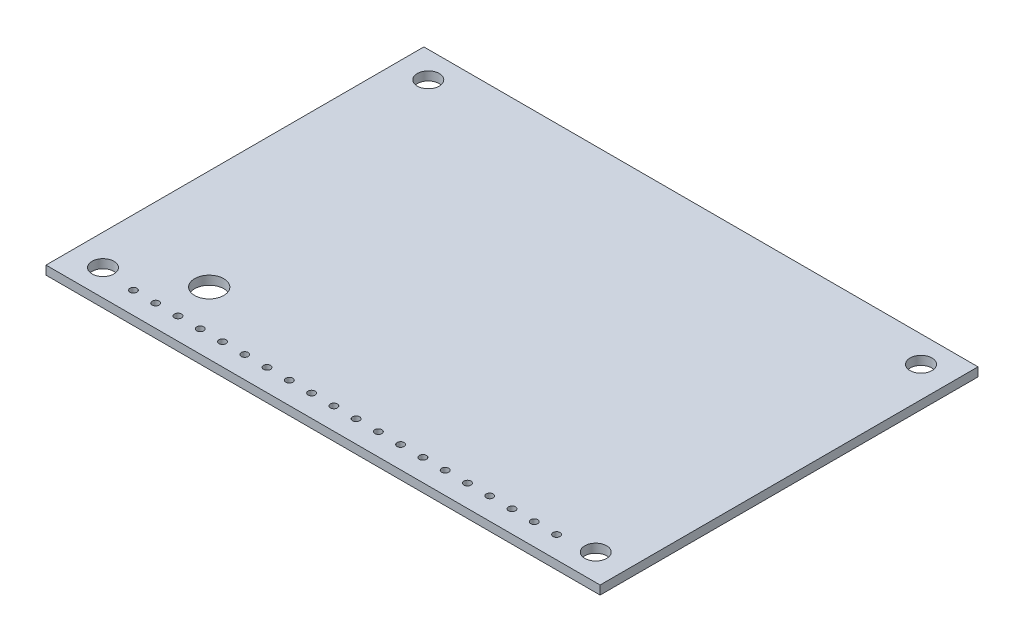
from build123d import *

# Parameters (mm, degrees)
SKETCH1_W           = 63.2
SKETCH1_H           = 43.1
BOSS_EXTRUDE1_DEPTH = 1
CUT_EXTRUDE1_REACH  = 78.504
SKETCH2_R           = 1.25
CUT_EXTRUDE2_REACH  = 78.504
SKETCH3_R           = 0.4
CUT_EXTRUDE18_REACH = 78.504
SKETCH25_R          = 1.663368104


with BuildPart() as part:
    # Sketch1 → Boss-Extrude1 (new body)
    with BuildSketch(Plane(origin=(0, 0, 0), x_dir=(1, 0, 0), z_dir=(0, 1, 0))):
        with Locations((31.6, 21.55)):
            Rectangle(SKETCH1_W, SKETCH1_H)
    extrude(amount=BOSS_EXTRUDE1_DEPTH)

    # Sketch2 → Cut-Extrude1 (cut, up to next)
    with BuildSketch(Plane(origin=(0, 1, 0), x_dir=(1, 0, 0), z_dir=(0, 1, 0)), mode=Mode.PRIVATE) as cut_extrude1_sk1:
        with Locations(Location((3.5, 40.1, 0), (0, 0, 270))):
            Circle(SKETCH2_R)
    cut_extrude1_tool1 = extrude(cut_extrude1_sk1.sketch, amount=-CUT_EXTRUDE1_REACH, mode=Mode.PRIVATE) & part.part
    # Sketch2 → Cut-Extrude1 (cut, up to next)
    with BuildSketch(Plane(origin=(0, 1, 0), x_dir=(1, 0, 0), z_dir=(0, 1, 0)), mode=Mode.PRIVATE) as cut_extrude1_sk2:
        with Locations(Location((59.7, 40.1, 0), (0, 0, 270))):
            Circle(SKETCH2_R)
    cut_extrude1_tool2 = extrude(cut_extrude1_sk2.sketch, amount=-CUT_EXTRUDE1_REACH, mode=Mode.PRIVATE) & part.part
    # Sketch2 → Cut-Extrude1 (cut, up to next)
    with BuildSketch(Plane(origin=(0, 1, 0), x_dir=(1, 0, 0), z_dir=(0, 1, 0)), mode=Mode.PRIVATE) as cut_extrude1_sk3:
        with Locations(Location((59.7, 3, 0), (0, 0, 270))):
            Circle(SKETCH2_R)
    cut_extrude1_tool3 = extrude(cut_extrude1_sk3.sketch, amount=-CUT_EXTRUDE1_REACH, mode=Mode.PRIVATE) & part.part
    # Sketch2 → Cut-Extrude1 (cut, up to next)
    with BuildSketch(Plane(origin=(0, 1, 0), x_dir=(1, 0, 0), z_dir=(0, 1, 0)), mode=Mode.PRIVATE) as cut_extrude1_sk4:
        with Locations(Location((3.5, 3, 0), (0, 0, 270))):
            Circle(SKETCH2_R)
    cut_extrude1_tool4 = extrude(cut_extrude1_sk4.sketch, amount=-CUT_EXTRUDE1_REACH, mode=Mode.PRIVATE) & part.part
    add(cut_extrude1_tool1.solids().sort_by_distance((3.5, 1, -40.1))[0], mode=Mode.SUBTRACT)
    add(cut_extrude1_tool2.solids().sort_by_distance((59.7, 1, -40.1))[0], mode=Mode.SUBTRACT)
    add(cut_extrude1_tool3.solids().sort_by_distance((59.7, 1, -3))[0], mode=Mode.SUBTRACT)
    add(cut_extrude1_tool4.solids().sort_by_distance((3.5, 1, -3))[0], mode=Mode.SUBTRACT)

    # Sketch3 → Cut-Extrude2 (cut, up to next)
    with BuildSketch(Plane(origin=(0, 1, 0), x_dir=(1, 0, 0), z_dir=(0, 1, 0)), mode=Mode.PRIVATE) as cut_extrude2_sk1:
        with Locations(Location((7.47, 2.5, 0), (0, 0, 270))):
            Circle(SKETCH3_R)
    cut_extrude2_tool1 = extrude(cut_extrude2_sk1.sketch, amount=-CUT_EXTRUDE2_REACH, mode=Mode.PRIVATE) & part.part
    # Sketch3 → Cut-Extrude2 (cut, up to next)
    with BuildSketch(Plane(origin=(0, 1, 0), x_dir=(1, 0, 0), z_dir=(0, 1, 0)), mode=Mode.PRIVATE) as cut_extrude2_sk2:
        with Locations(Location((10.01, 2.5, 0), (0, 0, 270))):
            Circle(SKETCH3_R)
    cut_extrude2_tool2 = extrude(cut_extrude2_sk2.sketch, amount=-CUT_EXTRUDE2_REACH, mode=Mode.PRIVATE) & part.part
    # Sketch3 → Cut-Extrude2 (cut, up to next)
    with BuildSketch(Plane(origin=(0, 1, 0), x_dir=(1, 0, 0), z_dir=(0, 1, 0)), mode=Mode.PRIVATE) as cut_extrude2_sk3:
        with Locations(Location((12.55, 2.5, 0), (0, 0, 270))):
            Circle(SKETCH3_R)
    cut_extrude2_tool3 = extrude(cut_extrude2_sk3.sketch, amount=-CUT_EXTRUDE2_REACH, mode=Mode.PRIVATE) & part.part
    # Sketch3 → Cut-Extrude2 (cut, up to next)
    with BuildSketch(Plane(origin=(0, 1, 0), x_dir=(1, 0, 0), z_dir=(0, 1, 0)), mode=Mode.PRIVATE) as cut_extrude2_sk4:
        with Locations(Location((15.09, 2.5, 0), (0, 0, 270))):
            Circle(SKETCH3_R)
    cut_extrude2_tool4 = extrude(cut_extrude2_sk4.sketch, amount=-CUT_EXTRUDE2_REACH, mode=Mode.PRIVATE) & part.part
    # Sketch3 → Cut-Extrude2 (cut, up to next)
    with BuildSketch(Plane(origin=(0, 1, 0), x_dir=(1, 0, 0), z_dir=(0, 1, 0)), mode=Mode.PRIVATE) as cut_extrude2_sk5:
        with Locations(Location((17.63, 2.5, 0), (0, 0, 270))):
            Circle(SKETCH3_R)
    cut_extrude2_tool5 = extrude(cut_extrude2_sk5.sketch, amount=-CUT_EXTRUDE2_REACH, mode=Mode.PRIVATE) & part.part
    # Sketch3 → Cut-Extrude2 (cut, up to next)
    with BuildSketch(Plane(origin=(0, 1, 0), x_dir=(1, 0, 0), z_dir=(0, 1, 0)), mode=Mode.PRIVATE) as cut_extrude2_sk6:
        with Locations(Location((20.17, 2.5, 0), (0, 0, 270))):
            Circle(SKETCH3_R)
    cut_extrude2_tool6 = extrude(cut_extrude2_sk6.sketch, amount=-CUT_EXTRUDE2_REACH, mode=Mode.PRIVATE) & part.part
    # Sketch3 → Cut-Extrude2 (cut, up to next)
    with BuildSketch(Plane(origin=(0, 1, 0), x_dir=(1, 0, 0), z_dir=(0, 1, 0)), mode=Mode.PRIVATE) as cut_extrude2_sk7:
        with Locations(Location((22.71, 2.5, 0), (0, 0, 270))):
            Circle(SKETCH3_R)
    cut_extrude2_tool7 = extrude(cut_extrude2_sk7.sketch, amount=-CUT_EXTRUDE2_REACH, mode=Mode.PRIVATE) & part.part
    # Sketch3 → Cut-Extrude2 (cut, up to next)
    with BuildSketch(Plane(origin=(0, 1, 0), x_dir=(1, 0, 0), z_dir=(0, 1, 0)), mode=Mode.PRIVATE) as cut_extrude2_sk8:
        with Locations(Location((25.25, 2.5, 0), (0, 0, 270))):
            Circle(SKETCH3_R)
    cut_extrude2_tool8 = extrude(cut_extrude2_sk8.sketch, amount=-CUT_EXTRUDE2_REACH, mode=Mode.PRIVATE) & part.part
    # Sketch3 → Cut-Extrude2 (cut, up to next)
    with BuildSketch(Plane(origin=(0, 1, 0), x_dir=(1, 0, 0), z_dir=(0, 1, 0)), mode=Mode.PRIVATE) as cut_extrude2_sk9:
        with Locations(Location((27.79, 2.5, 0), (0, 0, 270))):
            Circle(SKETCH3_R)
    cut_extrude2_tool9 = extrude(cut_extrude2_sk9.sketch, amount=-CUT_EXTRUDE2_REACH, mode=Mode.PRIVATE) & part.part
    # Sketch3 → Cut-Extrude2 (cut, up to next)
    with BuildSketch(Plane(origin=(0, 1, 0), x_dir=(1, 0, 0), z_dir=(0, 1, 0)), mode=Mode.PRIVATE) as cut_extrude2_sk10:
        with Locations(Location((30.33, 2.5, 0), (0, 0, 270))):
            Circle(SKETCH3_R)
    cut_extrude2_tool10 = extrude(cut_extrude2_sk10.sketch, amount=-CUT_EXTRUDE2_REACH, mode=Mode.PRIVATE) & part.part
    # Sketch3 → Cut-Extrude2 (cut, up to next)
    with BuildSketch(Plane(origin=(0, 1, 0), x_dir=(1, 0, 0), z_dir=(0, 1, 0)), mode=Mode.PRIVATE) as cut_extrude2_sk11:
        with Locations(Location((32.87, 2.5, 0), (0, 0, 270))):
            Circle(SKETCH3_R)
    cut_extrude2_tool11 = extrude(cut_extrude2_sk11.sketch, amount=-CUT_EXTRUDE2_REACH, mode=Mode.PRIVATE) & part.part
    # Sketch3 → Cut-Extrude2 (cut, up to next)
    with BuildSketch(Plane(origin=(0, 1, 0), x_dir=(1, 0, 0), z_dir=(0, 1, 0)), mode=Mode.PRIVATE) as cut_extrude2_sk12:
        with Locations(Location((35.41, 2.5, 0), (0, 0, 270))):
            Circle(SKETCH3_R)
    cut_extrude2_tool12 = extrude(cut_extrude2_sk12.sketch, amount=-CUT_EXTRUDE2_REACH, mode=Mode.PRIVATE) & part.part
    # Sketch3 → Cut-Extrude2 (cut, up to next)
    with BuildSketch(Plane(origin=(0, 1, 0), x_dir=(1, 0, 0), z_dir=(0, 1, 0)), mode=Mode.PRIVATE) as cut_extrude2_sk13:
        with Locations(Location((37.95, 2.5, 0), (0, 0, 270))):
            Circle(SKETCH3_R)
    cut_extrude2_tool13 = extrude(cut_extrude2_sk13.sketch, amount=-CUT_EXTRUDE2_REACH, mode=Mode.PRIVATE) & part.part
    # Sketch3 → Cut-Extrude2 (cut, up to next)
    with BuildSketch(Plane(origin=(0, 1, 0), x_dir=(1, 0, 0), z_dir=(0, 1, 0)), mode=Mode.PRIVATE) as cut_extrude2_sk14:
        with Locations(Location((40.49, 2.5, 0), (0, 0, 270))):
            Circle(SKETCH3_R)
    cut_extrude2_tool14 = extrude(cut_extrude2_sk14.sketch, amount=-CUT_EXTRUDE2_REACH, mode=Mode.PRIVATE) & part.part
    # Sketch3 → Cut-Extrude2 (cut, up to next)
    with BuildSketch(Plane(origin=(0, 1, 0), x_dir=(1, 0, 0), z_dir=(0, 1, 0)), mode=Mode.PRIVATE) as cut_extrude2_sk15:
        with Locations(Location((43.03, 2.5, 0), (0, 0, 270))):
            Circle(SKETCH3_R)
    cut_extrude2_tool15 = extrude(cut_extrude2_sk15.sketch, amount=-CUT_EXTRUDE2_REACH, mode=Mode.PRIVATE) & part.part
    # Sketch3 → Cut-Extrude2 (cut, up to next)
    with BuildSketch(Plane(origin=(0, 1, 0), x_dir=(1, 0, 0), z_dir=(0, 1, 0)), mode=Mode.PRIVATE) as cut_extrude2_sk16:
        with Locations(Location((45.57, 2.5, 0), (0, 0, 270))):
            Circle(SKETCH3_R)
    cut_extrude2_tool16 = extrude(cut_extrude2_sk16.sketch, amount=-CUT_EXTRUDE2_REACH, mode=Mode.PRIVATE) & part.part
    # Sketch3 → Cut-Extrude2 (cut, up to next)
    with BuildSketch(Plane(origin=(0, 1, 0), x_dir=(1, 0, 0), z_dir=(0, 1, 0)), mode=Mode.PRIVATE) as cut_extrude2_sk17:
        with Locations(Location((48.11, 2.5, 0), (0, 0, 270))):
            Circle(SKETCH3_R)
    cut_extrude2_tool17 = extrude(cut_extrude2_sk17.sketch, amount=-CUT_EXTRUDE2_REACH, mode=Mode.PRIVATE) & part.part
    # Sketch3 → Cut-Extrude2 (cut, up to next)
    with BuildSketch(Plane(origin=(0, 1, 0), x_dir=(1, 0, 0), z_dir=(0, 1, 0)), mode=Mode.PRIVATE) as cut_extrude2_sk18:
        with Locations(Location((50.65, 2.5, 0), (0, 0, 270))):
            Circle(SKETCH3_R)
    cut_extrude2_tool18 = extrude(cut_extrude2_sk18.sketch, amount=-CUT_EXTRUDE2_REACH, mode=Mode.PRIVATE) & part.part
    # Sketch3 → Cut-Extrude2 (cut, up to next)
    with BuildSketch(Plane(origin=(0, 1, 0), x_dir=(1, 0, 0), z_dir=(0, 1, 0)), mode=Mode.PRIVATE) as cut_extrude2_sk19:
        with Locations(Location((53.19, 2.5, 0), (0, 0, 270))):
            Circle(SKETCH3_R)
    cut_extrude2_tool19 = extrude(cut_extrude2_sk19.sketch, amount=-CUT_EXTRUDE2_REACH, mode=Mode.PRIVATE) & part.part
    # Sketch3 → Cut-Extrude2 (cut, up to next)
    with BuildSketch(Plane(origin=(0, 1, 0), x_dir=(1, 0, 0), z_dir=(0, 1, 0)), mode=Mode.PRIVATE) as cut_extrude2_sk20:
        with Locations(Location((55.73, 2.5, 0), (0, 0, 270))):
            Circle(SKETCH3_R)
    cut_extrude2_tool20 = extrude(cut_extrude2_sk20.sketch, amount=-CUT_EXTRUDE2_REACH, mode=Mode.PRIVATE) & part.part
    add(cut_extrude2_tool1.solids().sort_by_distance((7.47, 1, -2.5))[0], mode=Mode.SUBTRACT)
    add(cut_extrude2_tool2.solids().sort_by_distance((10.01, 1, -2.5))[0], mode=Mode.SUBTRACT)
    add(cut_extrude2_tool3.solids().sort_by_distance((12.55, 1, -2.5))[0], mode=Mode.SUBTRACT)
    add(cut_extrude2_tool4.solids().sort_by_distance((15.09, 1, -2.5))[0], mode=Mode.SUBTRACT)
    add(cut_extrude2_tool5.solids().sort_by_distance((17.63, 1, -2.5))[0], mode=Mode.SUBTRACT)
    add(cut_extrude2_tool6.solids().sort_by_distance((20.17, 1, -2.5))[0], mode=Mode.SUBTRACT)
    add(cut_extrude2_tool7.solids().sort_by_distance((22.71, 1, -2.5))[0], mode=Mode.SUBTRACT)
    add(cut_extrude2_tool8.solids().sort_by_distance((25.25, 1, -2.5))[0], mode=Mode.SUBTRACT)
    add(cut_extrude2_tool9.solids().sort_by_distance((27.79, 1, -2.5))[0], mode=Mode.SUBTRACT)
    add(cut_extrude2_tool10.solids().sort_by_distance((30.33, 1, -2.5))[0], mode=Mode.SUBTRACT)
    add(cut_extrude2_tool11.solids().sort_by_distance((32.87, 1, -2.5))[0], mode=Mode.SUBTRACT)
    add(cut_extrude2_tool12.solids().sort_by_distance((35.41, 1, -2.5))[0], mode=Mode.SUBTRACT)
    add(cut_extrude2_tool13.solids().sort_by_distance((37.95, 1, -2.5))[0], mode=Mode.SUBTRACT)
    add(cut_extrude2_tool14.solids().sort_by_distance((40.49, 1, -2.5))[0], mode=Mode.SUBTRACT)
    add(cut_extrude2_tool15.solids().sort_by_distance((43.03, 1, -2.5))[0], mode=Mode.SUBTRACT)
    add(cut_extrude2_tool16.solids().sort_by_distance((45.57, 1, -2.5))[0], mode=Mode.SUBTRACT)
    add(cut_extrude2_tool17.solids().sort_by_distance((48.11, 1, -2.5))[0], mode=Mode.SUBTRACT)
    add(cut_extrude2_tool18.solids().sort_by_distance((50.65, 1, -2.5))[0], mode=Mode.SUBTRACT)
    add(cut_extrude2_tool19.solids().sort_by_distance((53.19, 1, -2.5))[0], mode=Mode.SUBTRACT)
    add(cut_extrude2_tool20.solids().sort_by_distance((55.73, 1, -2.5))[0], mode=Mode.SUBTRACT)

    # Sketch25 → Cut-Extrude18 (cut, up to next)
    with BuildSketch(Plane.XZ, mode=Mode.PRIVATE) as cut_extrude18_sk1:
        with Locations(Location((11.478536319, -7.136146005, 0), (0, 0, 270))):
            Circle(SKETCH25_R)
    cut_extrude18_tool1 = extrude(cut_extrude18_sk1.sketch, amount=-CUT_EXTRUDE18_REACH, mode=Mode.PRIVATE) & part.part
    add(cut_extrude18_tool1.solids().sort_by_distance((11.478536, 0, -7.136146))[0], mode=Mode.SUBTRACT)


solid = part.part
